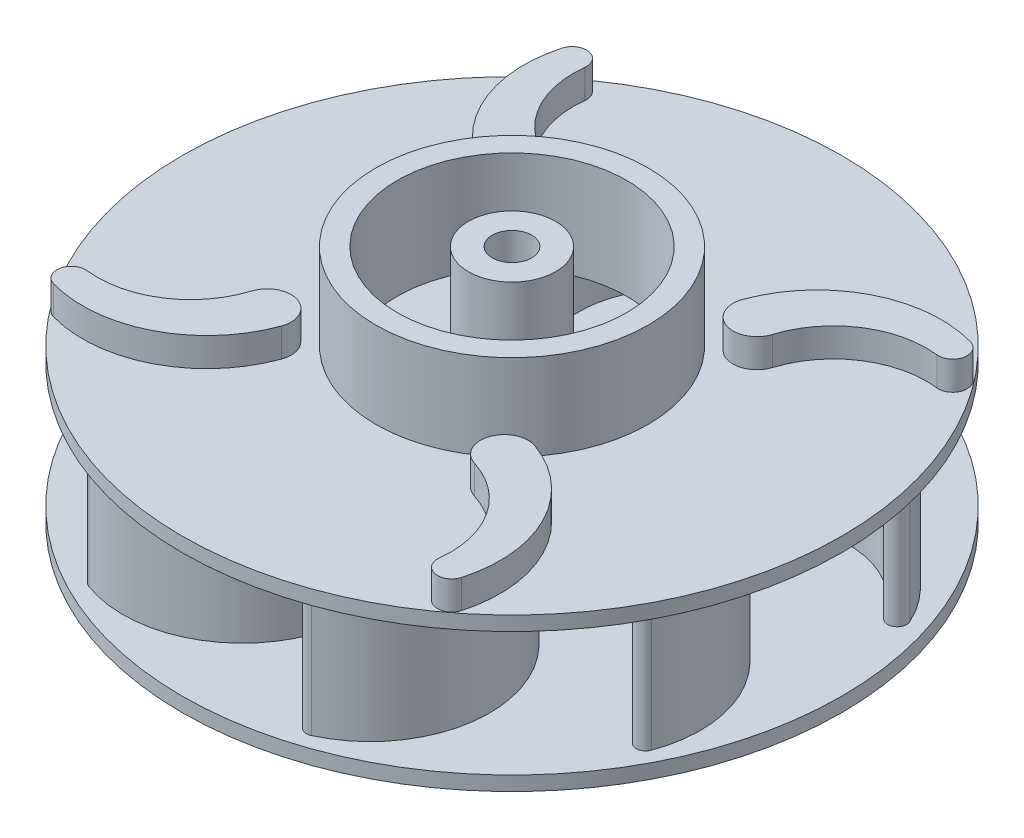
from build123d import *

# Parameters (mm, degrees)
SKETCH1_R           = 276
SKETCH1_R_2         = 16.5
BOSS_EXTRUDE1_DEPTH = 12
SKETCH2_R           = 36.5
SKETCH2_R_2         = 16.5
BOSS_EXTRUDE2_DEPTH = 104
SKETCH4_R           = 276
SKETCH4_R_2         = 96
BOSS_EXTRUDE6_DEPTH = 12
BOSS_EXTRUDE7_DEPTH = 24
SKETCH6_R           = 114
SKETCH6_R_2         = 96
BOSS_EXTRUDE8_DEPTH = 72
FILLET1_R           = 14
SKETCH7_R           = 36.5
SKETCH7_R_2         = 16.5
BOSS_EXTRUDE9_DEPTH = 84


with BuildPart() as part:
    # Sketch1 → Boss-Extrude1 (new body)
    with BuildSketch(Plane(origin=(0, 0, 0), x_dir=(1, 0, 0), z_dir=(0, 1, 0))):
        with Locations(Location((0, 0, 0), (0, 0, 270))):
            Circle(SKETCH1_R)
        with Locations(Location((0, 0, 0), (0, 0, 270))):
            Circle(SKETCH1_R_2, mode=Mode.SUBTRACT)
    extrude(amount=BOSS_EXTRUDE1_DEPTH)

    # Sketch2 → Boss-Extrude2 (add)
    # profile 1 of 9: a face of its own
    with BuildSketch(Plane(origin=(0, 12, 0), x_dir=(1, 0, 0), z_dir=(0, 1, 0))):
        with Locations(Location((0, 0, 0), (0, 0, 90))):
            Circle(SKETCH2_R)
        with Locations(Location((0, 0, 0), (0, 0, 270))):
            Circle(SKETCH2_R_2, mode=Mode.SUBTRACT)
    # profile 2 of 9: a face of its own
    with BuildSketch(Plane(origin=(0, 12, 0), x_dir=(1, 0, 0), z_dir=(0, 1, 0))):
        with BuildLine():
            ThreePointArc((15.99428821, -144.42748644), (0.354884611, -128.003936206), (-15.997509824, -143.717724529))
            ThreePointArc((-15.997509824, -143.717724529), (-46.818792615, -205.414811389), (-114.180459904, -220.209667925))
            ThreePointArc((-114.180459904, -220.209667925), (-123.660150756, -225.693034374), (-118.785216252, -235.499504679))
            ThreePointArc((-118.785216252, -235.499504679), (-27.982252168, -224.613228291), (15.99428821, -144.42748644))
        make_face()
    # profile 3 of 9: a face of its own
    with BuildSketch(Plane(origin=(0, 12, 0), x_dir=(1, 0, 0), z_dir=(0, 1, 0))):
        with BuildLine():
            ThreePointArc((-90.815985398, -113.435324705), (-90.261509995, -90.763392625), (-112.93572527, -90.311829913))
            ThreePointArc((-112.93572527, -90.311829913), (-178.356091834, -112.144320345), (-236.44952695, -74.973971996))
            ThreePointArc((-236.44952695, -74.973971996), (-247.030006234, -72.14814391), (-250.517128641, -82.529464808))
            ThreePointArc((-250.517128641, -82.529464808), (-178.61197713, -139.039096608), (-90.815985398, -113.435324705))
        make_face()
    # profile 4 of 9: a face of its own
    with BuildSketch(Plane(origin=(0, 12, 0), x_dir=(1, 0, 0), z_dir=(0, 1, 0))):
        with BuildLine():
            ThreePointArc((-144.42748644, -15.99428821), (-128.003936206, -0.354884611), (-143.717724529, 15.997509824))
            ThreePointArc((-143.717724529, 15.997509824), (-205.414811389, 46.818792615), (-220.209667925, 114.180459904))
            ThreePointArc((-220.209667925, 114.180459904), (-225.693034374, 123.660150756), (-235.499504679, 118.785216252))
            ThreePointArc((-235.499504679, 118.785216252), (-224.613228291, 27.982252168), (-144.42748644, -15.99428821))
        make_face()
    # profile 5 of 9: a face of its own
    with BuildSketch(Plane(origin=(0, 12, 0), x_dir=(1, 0, 0), z_dir=(0, 1, 0))):
        with BuildLine():
            ThreePointArc((-113.435324705, 90.815985398), (-90.763392625, 90.261509995), (-90.311829913, 112.93572527))
            ThreePointArc((-90.311829913, 112.93572527), (-112.144320345, 178.356091834), (-74.973971996, 236.44952695))
            ThreePointArc((-74.973971996, 236.44952695), (-72.14814391, 247.030006234), (-82.529464808, 250.517128641))
            ThreePointArc((-82.529464808, 250.517128641), (-139.039096608, 178.61197713), (-113.435324705, 90.815985398))
        make_face()
    # profile 6 of 9: a face of its own
    with BuildSketch(Plane(origin=(0, 12, 0), x_dir=(1, 0, 0), z_dir=(0, 1, 0))):
        with BuildLine():
            ThreePointArc((-15.99428821, 144.42748644), (-0.354884611, 128.003936206), (15.997509824, 143.717724529))
            ThreePointArc((15.997509824, 143.717724529), (46.818792615, 205.414811389), (114.180459904, 220.209667925))
            ThreePointArc((114.180459904, 220.209667925), (123.660150756, 225.693034374), (118.785216252, 235.499504679))
            ThreePointArc((118.785216252, 235.499504679), (27.982252168, 224.613228291), (-15.99428821, 144.42748644))
        make_face()
    # profile 7 of 9: a face of its own
    with BuildSketch(Plane(origin=(0, 12, 0), x_dir=(1, 0, 0), z_dir=(0, 1, 0))):
        with BuildLine():
            ThreePointArc((90.815985398, 113.435324705), (90.261509995, 90.763392625), (112.93572527, 90.311829913))
            ThreePointArc((112.93572527, 90.311829913), (178.356091834, 112.144320345), (236.44952695, 74.973971996))
            ThreePointArc((236.44952695, 74.973971996), (247.030006234, 72.14814391), (250.517128641, 82.529464808))
            ThreePointArc((250.517128641, 82.529464808), (178.61197713, 139.039096608), (90.815985398, 113.435324705))
        make_face()
    # profile 8 of 9: a face of its own
    with BuildSketch(Plane(origin=(0, 12, 0), x_dir=(1, 0, 0), z_dir=(0, 1, 0))):
        with BuildLine():
            ThreePointArc((144.42748644, 15.99428821), (128.003936206, 0.354884611), (143.717724529, -15.997509824))
            ThreePointArc((143.717724529, -15.997509824), (205.414811389, -46.818792615), (220.209667925, -114.180459904))
            ThreePointArc((220.209667925, -114.180459904), (225.693034374, -123.660150756), (235.499504679, -118.785216252))
            ThreePointArc((235.499504679, -118.785216252), (224.613228291, -27.982252168), (144.42748644, 15.99428821))
        make_face()
    # profile 9 of 9: a face of its own
    with BuildSketch(Plane(origin=(0, 12, 0), x_dir=(1, 0, 0), z_dir=(0, 1, 0))):
        with BuildLine():
            ThreePointArc((113.435324705, -90.815985398), (90.763392625, -90.261509995), (90.311829913, -112.93572527))
            ThreePointArc((90.311829913, -112.93572527), (112.144320345, -178.356091834), (74.973971996, -236.44952695))
            ThreePointArc((74.973971996, -236.44952695), (72.14814391, -247.030006234), (82.529464808, -250.517128641))
            ThreePointArc((82.529464808, -250.517128641), (139.039096608, -178.61197713), (113.435324705, -90.815985398))
        make_face()
    extrude(amount=BOSS_EXTRUDE2_DEPTH)

    # Sketch4 → Boss-Extrude6 (add)
    with BuildSketch(Plane(origin=(0, 116, 0), x_dir=(1, 0, 0), z_dir=(0, 1, 0))):
        with Locations(Location((0, 0, 0), (0, 0, 270))):
            Circle(SKETCH4_R)
        with Locations(Location((0, 0, 0), (0, 0, 270))):
            Circle(SKETCH4_R_2, mode=Mode.SUBTRACT)
    extrude(amount=BOSS_EXTRUDE6_DEPTH)

    # Sketch5 → Boss-Extrude7 (add)
    with BuildSketch(Plane(origin=(0, 128, 0), x_dir=(1, 0, 0), z_dir=(0, 1, 0))):
        with BuildLine():
            ThreePointArc((170.830485383, -212.939679185), (163.2534903, -137.16642294), (106.076926652, -86.868930102))
            ThreePointArc((106.076926652, -86.868930102), (80.332659261, -99.281912309), (93.285108283, -124.759029396))
            ThreePointArc((93.285108283, -124.759029396), (135.370747242, -156.776062336), (147.364000345, -208.278035938))
            ThreePointArc((147.364000345, -208.278035938), (156.943786511, -221.449251949), (170.830485383, -212.939679185))
        make_face()
        with BuildLine():
            ThreePointArc((-212.939679185, -170.830485383), (-137.16642294, -163.2534903), (-86.868930102, -106.076926652))
            ThreePointArc((-86.868930102, -106.076926652), (-99.281912309, -80.332659261), (-124.759029396, -93.285108283))
            ThreePointArc((-124.759029396, -93.285108283), (-156.776062336, -135.370747242), (-208.278035938, -147.364000345))
            ThreePointArc((-208.278035938, -147.364000345), (-221.449251949, -156.943786511), (-212.939679185, -170.830485383))
        make_face()
        with BuildLine():
            ThreePointArc((-170.830485383, 212.939679185), (-163.2534903, 137.16642294), (-106.076926652, 86.868930102))
            ThreePointArc((-106.076926652, 86.868930102), (-80.332659261, 99.281912309), (-93.285108283, 124.759029396))
            ThreePointArc((-93.285108283, 124.759029396), (-135.370747242, 156.776062336), (-147.364000345, 208.278035938))
            ThreePointArc((-147.364000345, 208.278035938), (-156.943786511, 221.449251949), (-170.830485383, 212.939679185))
        make_face()
        with BuildLine():
            ThreePointArc((212.939679185, 170.830485383), (137.16642294, 163.2534903), (86.868930102, 106.076926652))
            ThreePointArc((86.868930102, 106.076926652), (99.281912309, 80.332659261), (124.759029396, 93.285108283))
            ThreePointArc((124.759029396, 93.285108283), (156.776062336, 135.370747242), (208.278035938, 147.364000345))
            ThreePointArc((208.278035938, 147.364000345), (221.449251949, 156.943786511), (212.939679185, 170.830485383))
        make_face()
    extrude(amount=BOSS_EXTRUDE7_DEPTH)

    # Sketch6 → Boss-Extrude8 (add)
    with BuildSketch(Plane(origin=(0, 128, 0), x_dir=(1, 0, 0), z_dir=(0, 1, 0))):
        with Locations(Location((0, 0, 0), (0, 0, 270))):
            Circle(SKETCH6_R)
        with Locations(Location((0, 0, 0), (0, 0, 270))):
            Circle(SKETCH6_R_2, mode=Mode.SUBTRACT)
    extrude(amount=BOSS_EXTRUDE8_DEPTH)

    # Fillet1
    fillet1_edges = [part.edges().sort_by_distance(p)[0] for p in [
        (0, 12, 36.5),
    ]]
    fillet(fillet1_edges, radius=FILLET1_R)

    # Sketch7 → Boss-Extrude9 (add)
    with BuildSketch(Plane(origin=(0, 116, 0), x_dir=(1, 0, 0), z_dir=(0, 1, 0))):
        with Locations(Location((0, 0, 0), (0, 0, 90))):
            Circle(SKETCH7_R)
        with Locations(Location((0, 0, 0), (0, 0, 270))):
            Circle(SKETCH7_R_2, mode=Mode.SUBTRACT)
    extrude(amount=BOSS_EXTRUDE9_DEPTH)


solid = part.part
